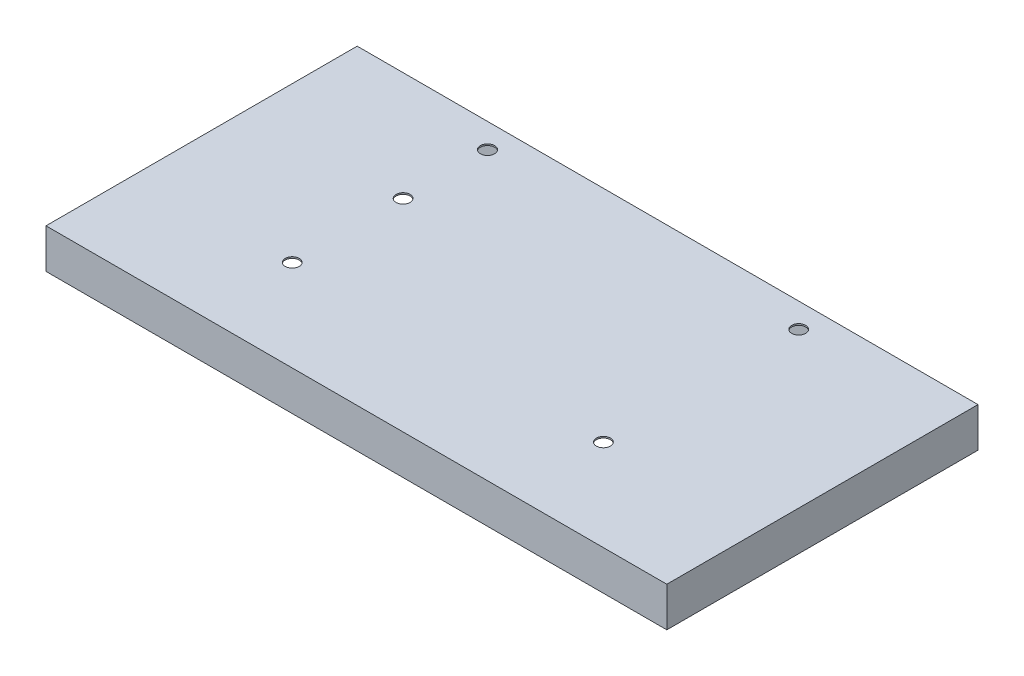
from build123d import *

# Parameters (mm, degrees)
CROQUIS1_W              = 798
CROQUIS1_H              = 400
SALIENTE_EXTRUIR1_DEPTH = 50.8
VACIADO1_T              = -1.9
CROQUIS3_R              = 9
CROQUIS3_R_2            = 9.17877309
CORTAR_EXTRUIR1_DEPTH   = 10


with BuildPart() as part:
    # Croquis1 → Saliente-Extruir1 (new body)
    with BuildSketch(Plane(origin=(0, 0, 0), x_dir=(1, 0, 0), z_dir=(0, 1, 0))):
        Rectangle(CROQUIS1_W, CROQUIS1_H)
    extrude(amount=SALIENTE_EXTRUIR1_DEPTH)

    # Vaciado1
    vaciado1_openings = [part.faces().sort_by_distance(p)[0] for p in [
        (0, 0, 0),
    ]]
    offset(amount=VACIADO1_T, openings=vaciado1_openings, kind=Kind.INTERSECTION)

    # Croquis3 → Cortar-Extruir1 (cut)
    with BuildSketch(Plane(origin=(0, 50.8, 0), x_dir=(1, 0, 0), z_dir=(0, 1, 0))):
        with Locations(Location((200, -82.5, 0), (0, 0, 270))):
            Circle(CROQUIS3_R)
        with Locations(Location((200, 168.5, 0), (0, 0, 270))):
            Circle(CROQUIS3_R)
        with Locations(Location((-200, -82.5, 0), (0, 0, 270))):
            Circle(CROQUIS3_R)
        with Locations(Location((-200, 60, 0), (0, 0, 270))):
            Circle(CROQUIS3_R)
        with Locations(Location((-200, 168.5, 0), (0, 0, 270))):
            Circle(CROQUIS3_R_2)
    extrude(amount=-CORTAR_EXTRUIR1_DEPTH, mode=Mode.SUBTRACT)


solid = part.part
